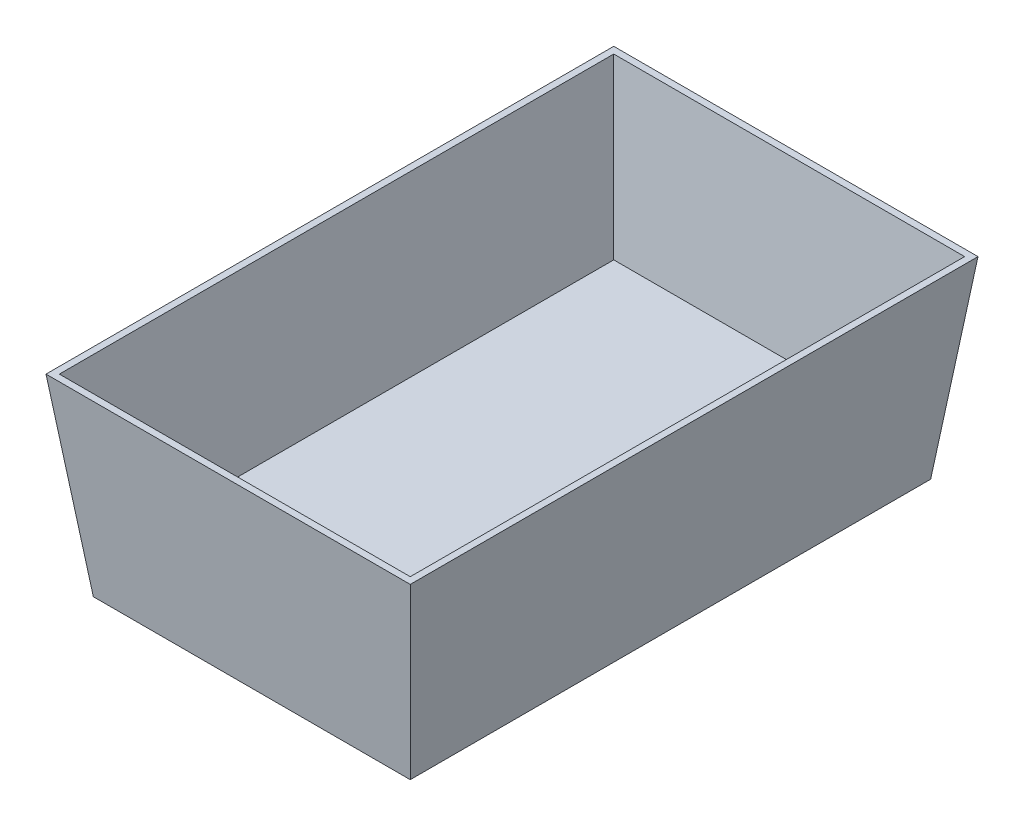
from build123d import *

# Parameters (mm, degrees)
SKETCH_1_W          = 475
SKETCH_1_H          = 780
EXTRUDE_1_DEPTH     = 289
EXTRUDE_1_DRAFT     = -7
SKETCH_2_W          = 525.969476202
SKETCH_2_H          = 830.969476202
CUT_EXTRUDE_1_DEPTH = 238
CUT_EXTRUDE_1_DRAFT = -7


with BuildPart() as part:
    # Эскиз1 → Бобышка-Вытянуть1 (with draft: the straight prism first)
    with BuildSketch(Plane(origin=(0, 0, 0), x_dir=(1, 0, 0), z_dir=(0, 1, 0))):
        with Locations((-465.395753162, -95.652339489)):
            Rectangle(SKETCH_1_W, SKETCH_1_H)
    extrude(amount=EXTRUDE_1_DEPTH)
    # Бобышка-Вытянуть1: the draft: its side faces are tilted about the plane it starts from
    extrude_1_sides = [part.faces().sort_by_distance(p)[0] for p in [
        (-465.395753162, 144.5, -294.347660511),
        (-702.895753162, 144.5, 95.652339489),
        (-465.395753162, 144.5, 485.652339489),
        (-227.895753162, 144.5, 95.652339489),
    ]]
    draft(extrude_1_sides, Plane(origin=(0, 0, 0), x_dir=(1, 0, 0), z_dir=(0, 1, 0)), EXTRUDE_1_DRAFT)


with BuildPart() as cut_extrude_1_tool:
    # Эскиз2 → Вырез-Вытянуть1 (with draft: the straight prism first)
    with BuildSketch(Plane(origin=(0, 289, 0), x_dir=(1, 0, 0), z_dir=(0, 1, 0))):
        with Locations((-465.395753162, -95.652339489)):
            Rectangle(SKETCH_2_W, SKETCH_2_H)
    extrude(amount=-CUT_EXTRUDE_1_DEPTH)
    # Вырез-Вытянуть1: the draft: its side faces are tilted about the plane it starts from
    cut_extrude_1_sides = [cut_extrude_1_tool.faces().sort_by_distance(p)[0] for p in [
        (-728.380491263, 170, 95.652339489),
        (-465.395753162, 170, 511.13707759),
        (-202.411015061, 170, 95.652339489),
        (-465.395753162, 170, -319.832398612),
    ]]
    draft(cut_extrude_1_sides, Plane(origin=(0, 289, 0), x_dir=(1, 0, 0), z_dir=(0, 1, 0)), CUT_EXTRUDE_1_DRAFT)


with BuildPart() as part_1:
    add(part.part)

    # Вырез-Вытянуть1: cut by cut_extrude_1_tool
    add(cut_extrude_1_tool.part, mode=Mode.SUBTRACT)


solid = part_1.part
